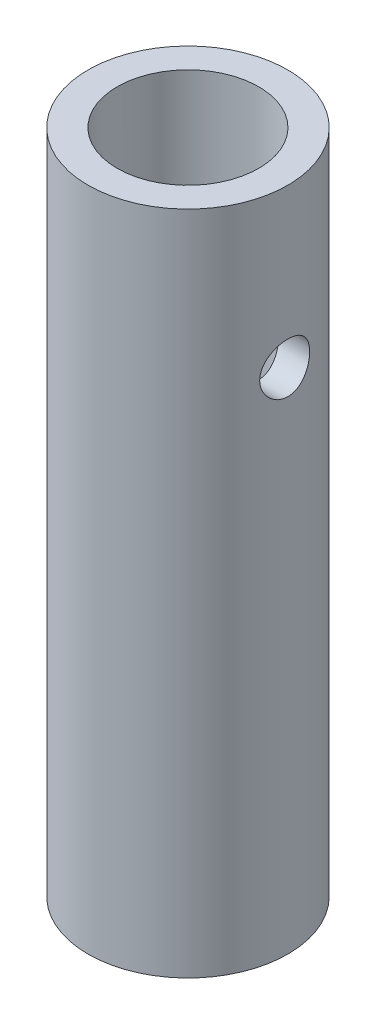
from build123d import *

# Parameters (mm, degrees)
SKETCH1_R               = 6
SKETCH1_R_2             = 4.25
BOSS_EXTRUDE1_DEPTH     = 40
CUT_EXTRUDE1_DEPTH      = 40
CUT_EXTRUDE1_DEPTH_BACK = 40
SKETCH2_R               = 1.5


with BuildPart() as part:
    # Sketch1 → Boss-Extrude1 (new body)
    with BuildSketch(Plane(origin=(0, 0, 0), x_dir=(1, 0, 0), z_dir=(0, 1, 0))):
        Circle(SKETCH1_R)
        Circle(SKETCH1_R_2, mode=Mode.SUBTRACT)
    extrude(amount=BOSS_EXTRUDE1_DEPTH)

    # Sketch2 → Cut-Extrude1 (cut, two sides: drawn at the far end of the back side and taken through both)
    with BuildSketch(Plane(origin=(0, 0, 0), x_dir=(0, 0, -1), z_dir=(1, 0, 0)).offset(-CUT_EXTRUDE1_DEPTH_BACK)):
        with Locations((0, 30.5)):
            Circle(SKETCH2_R)
    extrude(amount=CUT_EXTRUDE1_DEPTH + CUT_EXTRUDE1_DEPTH_BACK, mode=Mode.SUBTRACT)


solid = part.part
